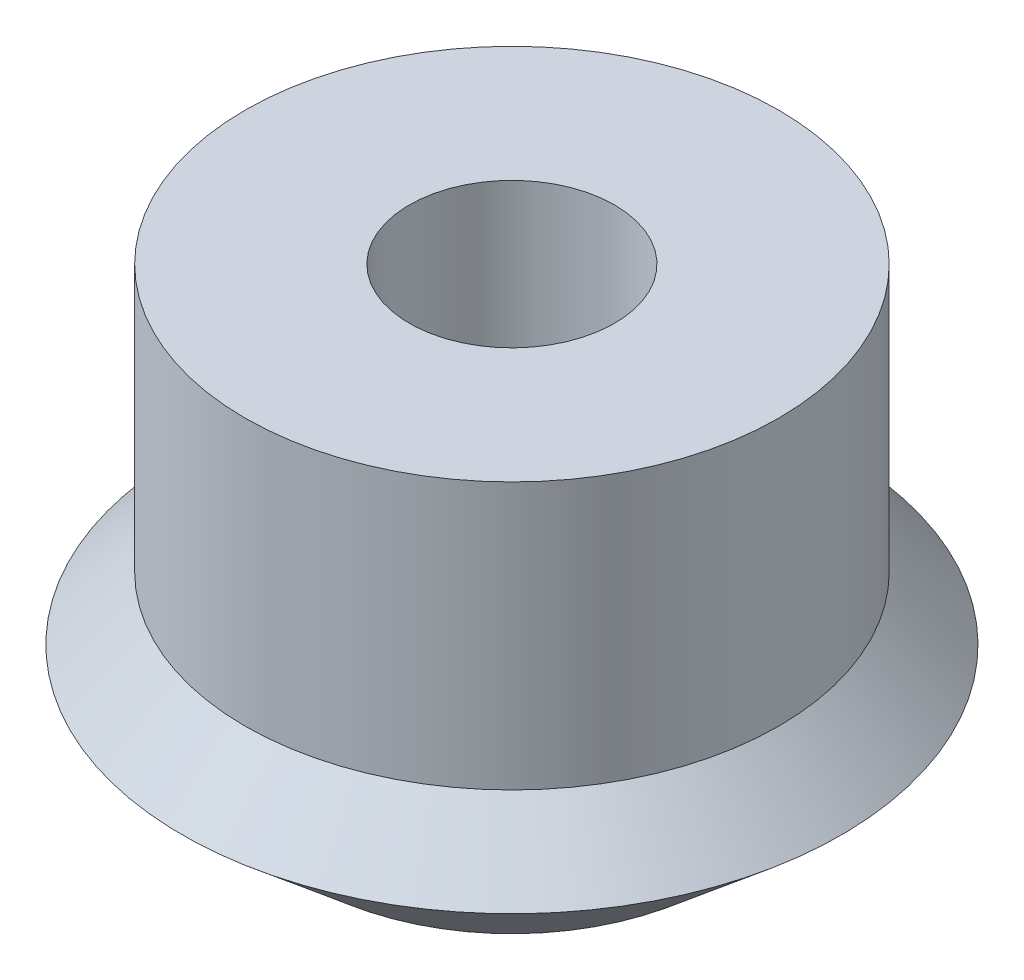
from build123d import *


with BuildPart() as part:
    # Sketch2 → Revolve1 (revolve)
    with BuildSketch(Plane.YZ, mode=Mode.PRIVATE) as revolve1_sk:
        Polygon((-11.743521681, 3.755235238), (-14.803521681, 6.815235238), (-19.967183183, 0.704867009), (-17.743521681, -1.559764762), (-17.743521681, -4.244764762), (1.256478319, -4.244764762), (1.256478319, -1.559764762), (1.256478319, 3.755235238), align=None)
    revolve(revolve1_sk.sketch.rotate(Axis((0, -25.391509901, -9.244764762), (0, 1, 0)), 180), axis=Axis((0, -25.391509901, -9.244764762), (0, 1, 0)))


solid = part.part
